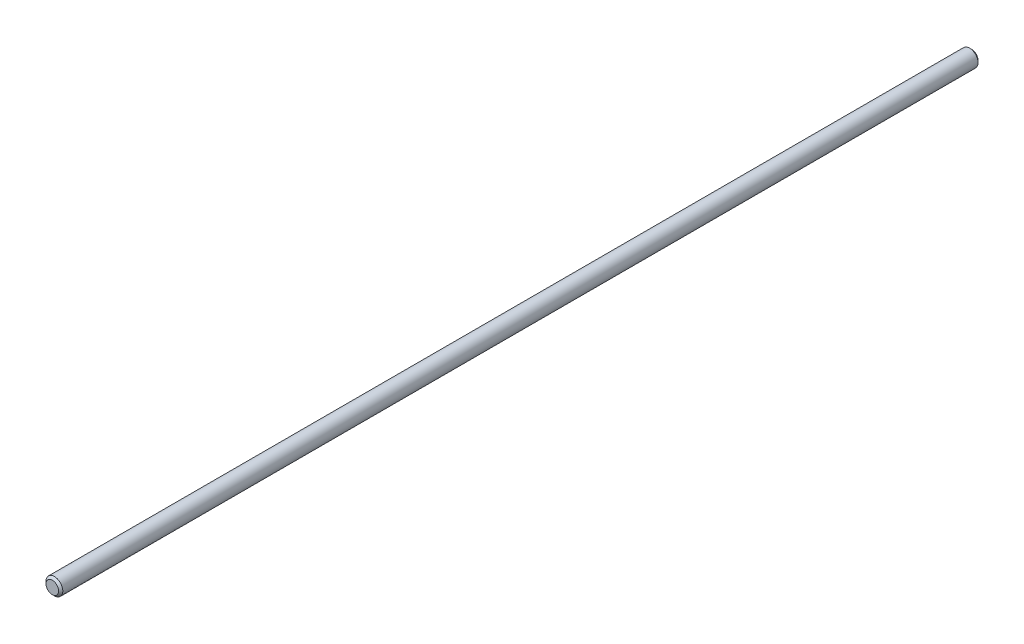
from build123d import *

# Parameters (mm, degrees)
SCHIZZO1_R                   = 4
ESTRUSIONE_ESTRUSIONE1_DEPTH = 438
SMUSSO1_SIZE                 = 1


with BuildPart() as part:
    # Schizzo1 → Estrusione-Estrusione1 (new body)
    with BuildSketch(Plane.XY):
        Circle(SCHIZZO1_R)
    extrude(amount=ESTRUSIONE_ESTRUSIONE1_DEPTH)

    # Smusso1
    smusso1_edges = [part.edges().sort_by_distance(p)[0] for p in [
        (-4, 0, 0),
        (-4, 0, 438),
    ]]
    chamfer(smusso1_edges, length=SMUSSO1_SIZE)


solid = part.part
